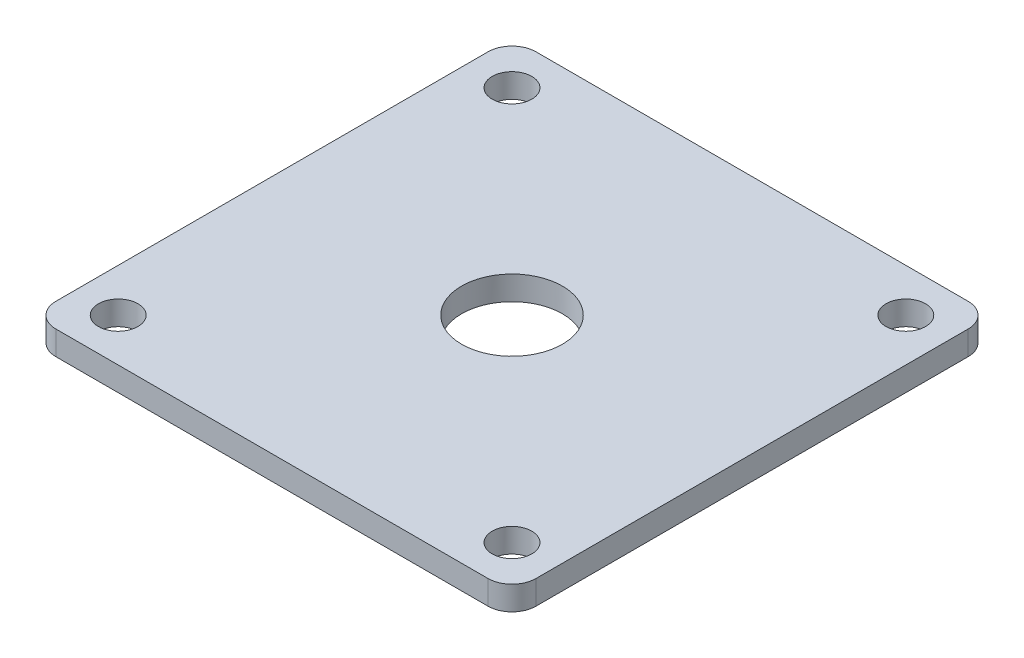
from build123d import *

# Parameters (mm, degrees)
SKETCH1_W           = 63.5
SKETCH1_H           = 63.5
BOSS_EXTRUDE1_DEPTH = 3.175
FILLET1_R           = 3.175
CUT_EXTRUDE1_REACH  = 47.013
SKETCH2_R           = 6.6675
CUT_EXTRUDE2_REACH  = 47.013
SKETCH3_R           = 2.6162


with BuildPart() as part:
    # Sketch1 → Boss-Extrude1 (new body)
    with BuildSketch(Plane(origin=(0, 0, 0), x_dir=(1, 0, 0), z_dir=(0, 1, 0))):
        Rectangle(SKETCH1_W, SKETCH1_H)
    extrude(amount=BOSS_EXTRUDE1_DEPTH)

    # Fillet1
    fillet1_edges = [part.edges().sort_by_distance(p)[0] for p in [
        (31.75, 1.5875, 31.75),
        (-31.75, 1.5875, 31.75),
        (-31.75, 1.5875, -31.75),
        (31.75, 1.5875, -31.75),
    ]]
    fillet(fillet1_edges, radius=FILLET1_R)

    # Sketch2 → Cut-Extrude1 (cut, up to next)
    with BuildSketch(Plane(origin=(0, 3.175, 0), x_dir=(1, 0, 0), z_dir=(0, 1, 0)), mode=Mode.PRIVATE) as cut_extrude1_sk1:
        with Locations(Location((0, 0, 0), (0, 0, 270))):
            Circle(SKETCH2_R)
    cut_extrude1_tool1 = extrude(cut_extrude1_sk1.sketch, amount=-CUT_EXTRUDE1_REACH, mode=Mode.PRIVATE) & part.part
    add(cut_extrude1_tool1.solids().sort_by_distance((0, 3.175, 0))[0], mode=Mode.SUBTRACT)

    # Sketch3 → Cut-Extrude2 (cut, up to next)
    with BuildSketch(Plane(origin=(0, 3.175, 0), x_dir=(1, 0, 0), z_dir=(0, 1, 0)), mode=Mode.PRIVATE) as cut_extrude2_sk1:
        with Locations(Location((26.042742751, -26.042742751, 0), (0, 0, 270))):
            Circle(SKETCH3_R)
    cut_extrude2_tool1 = extrude(cut_extrude2_sk1.sketch, amount=-CUT_EXTRUDE2_REACH, mode=Mode.PRIVATE) & part.part
    # Sketch3 → Cut-Extrude2 (cut, up to next)
    with BuildSketch(Plane(origin=(0, 3.175, 0), x_dir=(1, 0, 0), z_dir=(0, 1, 0)), mode=Mode.PRIVATE) as cut_extrude2_sk2:
        with Locations(Location((-26.042742751, -26.042742751, 0), (0, 0, 270))):
            Circle(SKETCH3_R)
    cut_extrude2_tool2 = extrude(cut_extrude2_sk2.sketch, amount=-CUT_EXTRUDE2_REACH, mode=Mode.PRIVATE) & part.part
    # Sketch3 → Cut-Extrude2 (cut, up to next)
    with BuildSketch(Plane(origin=(0, 3.175, 0), x_dir=(1, 0, 0), z_dir=(0, 1, 0)), mode=Mode.PRIVATE) as cut_extrude2_sk3:
        with Locations(Location((26.042742751, 26.042742751, 0), (0, 0, 90))):
            Circle(SKETCH3_R)
    cut_extrude2_tool3 = extrude(cut_extrude2_sk3.sketch, amount=-CUT_EXTRUDE2_REACH, mode=Mode.PRIVATE) & part.part
    # Sketch3 → Cut-Extrude2 (cut, up to next)
    with BuildSketch(Plane(origin=(0, 3.175, 0), x_dir=(1, 0, 0), z_dir=(0, 1, 0)), mode=Mode.PRIVATE) as cut_extrude2_sk4:
        with Locations(Location((-26.042742751, 26.042742751, 0), (0, 0, 90))):
            Circle(SKETCH3_R)
    cut_extrude2_tool4 = extrude(cut_extrude2_sk4.sketch, amount=-CUT_EXTRUDE2_REACH, mode=Mode.PRIVATE) & part.part
    add(cut_extrude2_tool1.solids().sort_by_distance((26.042743, 3.175, 26.042743))[0], mode=Mode.SUBTRACT)
    add(cut_extrude2_tool2.solids().sort_by_distance((-26.042743, 3.175, 26.042743))[0], mode=Mode.SUBTRACT)
    add(cut_extrude2_tool3.solids().sort_by_distance((26.042743, 3.175, -26.042743))[0], mode=Mode.SUBTRACT)
    add(cut_extrude2_tool4.solids().sort_by_distance((-26.042743, 3.175, -26.042743))[0], mode=Mode.SUBTRACT)


solid = part.part
